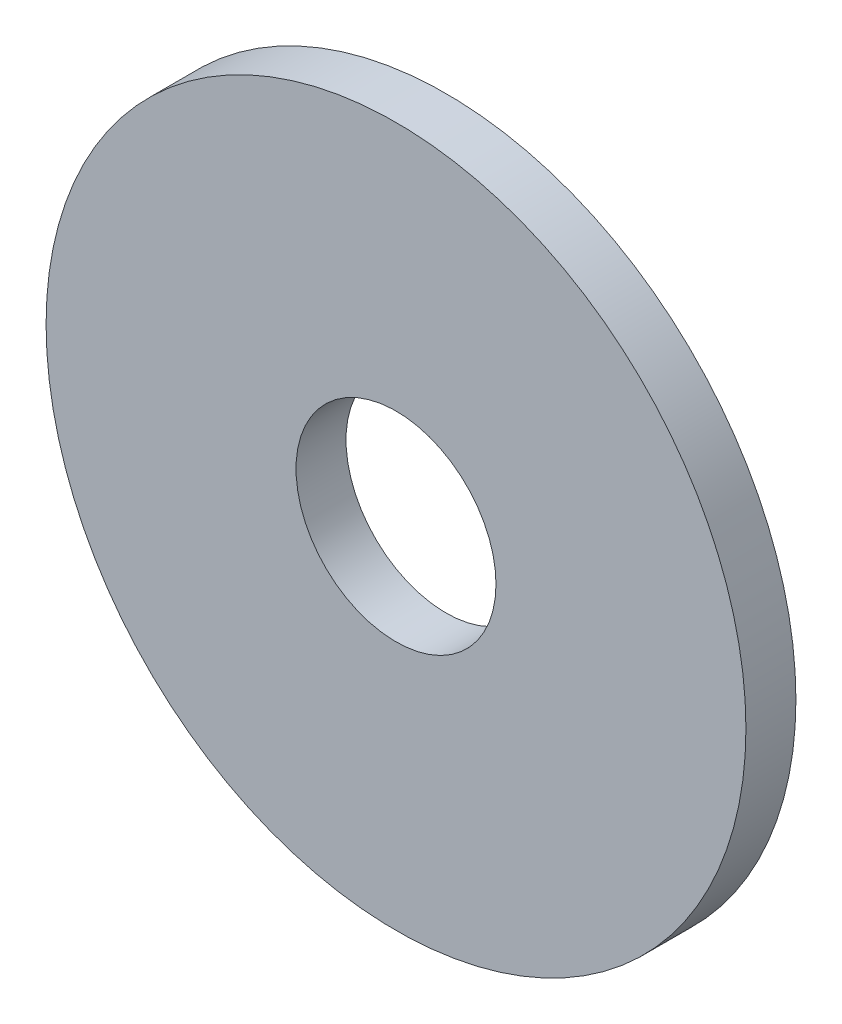
from build123d import *

# Parameters (mm, degrees)
SKETCH1_R           = 7
SKETCH1_R_2         = 2
BOSS_EXTRUDE1_DEPTH = 1


with BuildPart() as part:
    # Sketch1 → Boss-Extrude1 (new body)
    with BuildSketch(Plane.XY):
        Circle(SKETCH1_R)
        Circle(SKETCH1_R_2, mode=Mode.SUBTRACT)
    extrude(amount=BOSS_EXTRUDE1_DEPTH)


solid = part.part
